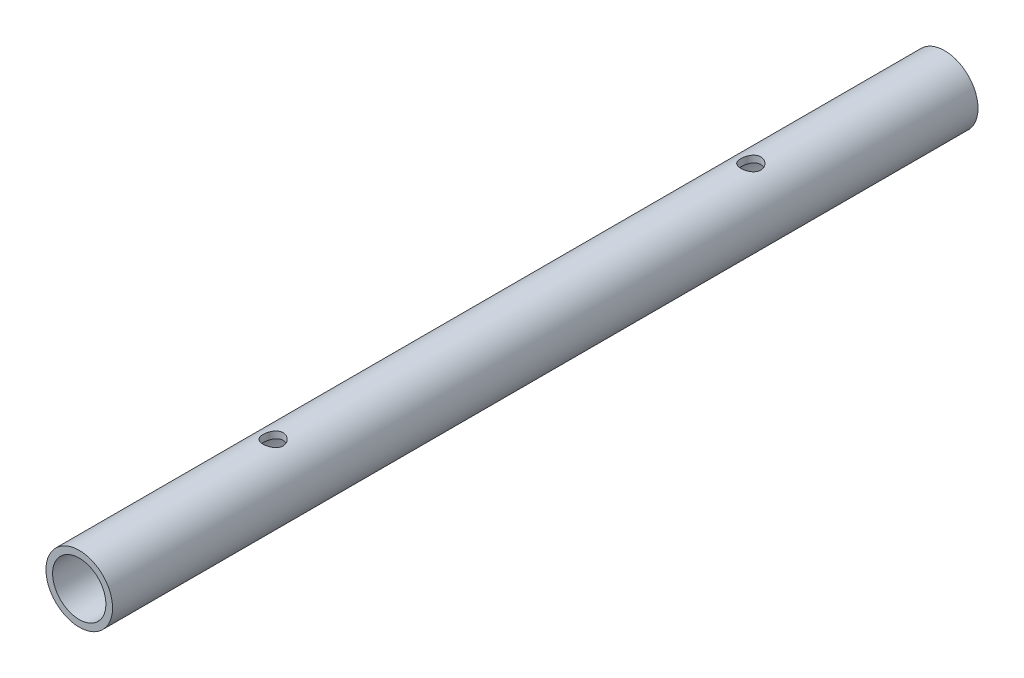
from build123d import *

# Parameters (mm, degrees)
SKETCH1_R               = 5
BOSS_EXTRUDE1_DEPTH     = 129.931
CUT_EXTRUDE1_REACH      = 132.123
SKETCH2_R               = 4
CUT_EXTRUDE2_DEPTH      = 131.123267562
CUT_EXTRUDE2_DEPTH_BACK = 131.123267562
SKETCH5_R               = 1.5


with BuildPart() as part:
    # Sketch1 → Boss-Extrude1 (new body)
    with BuildSketch(Plane.XY):
        Circle(SKETCH1_R)
    extrude(amount=BOSS_EXTRUDE1_DEPTH)

    # Sketch2 → Cut-Extrude1 (cut, up to next)
    with BuildSketch(Plane.XY.offset(129.931), mode=Mode.PRIVATE) as cut_extrude1_sk1:
        Circle(SKETCH2_R)
    cut_extrude1_tool1 = extrude(cut_extrude1_sk1.sketch, amount=-CUT_EXTRUDE1_REACH, mode=Mode.PRIVATE) & part.part
    add(cut_extrude1_tool1.solids().sort_by_distance((0, 0, 129.931))[0], mode=Mode.SUBTRACT)

    # Sketch5 → Cut-Extrude2 (cut, two sides: drawn at the far end of the back side and taken through both)
    with BuildSketch(Plane(origin=(0, 0, 0), x_dir=(1, 0, 0), z_dir=(0, 1, 0)).offset(-CUT_EXTRUDE2_DEPTH_BACK)):
        with Locations(Location((0, -29.104, 0), (0, 0, 270))):
            Circle(SKETCH5_R)
        with Locations(Location((0, -100.826, 0), (0, 0, 270))):
            Circle(SKETCH5_R)
    extrude(amount=CUT_EXTRUDE2_DEPTH + CUT_EXTRUDE2_DEPTH_BACK, mode=Mode.SUBTRACT)


solid = part.part
